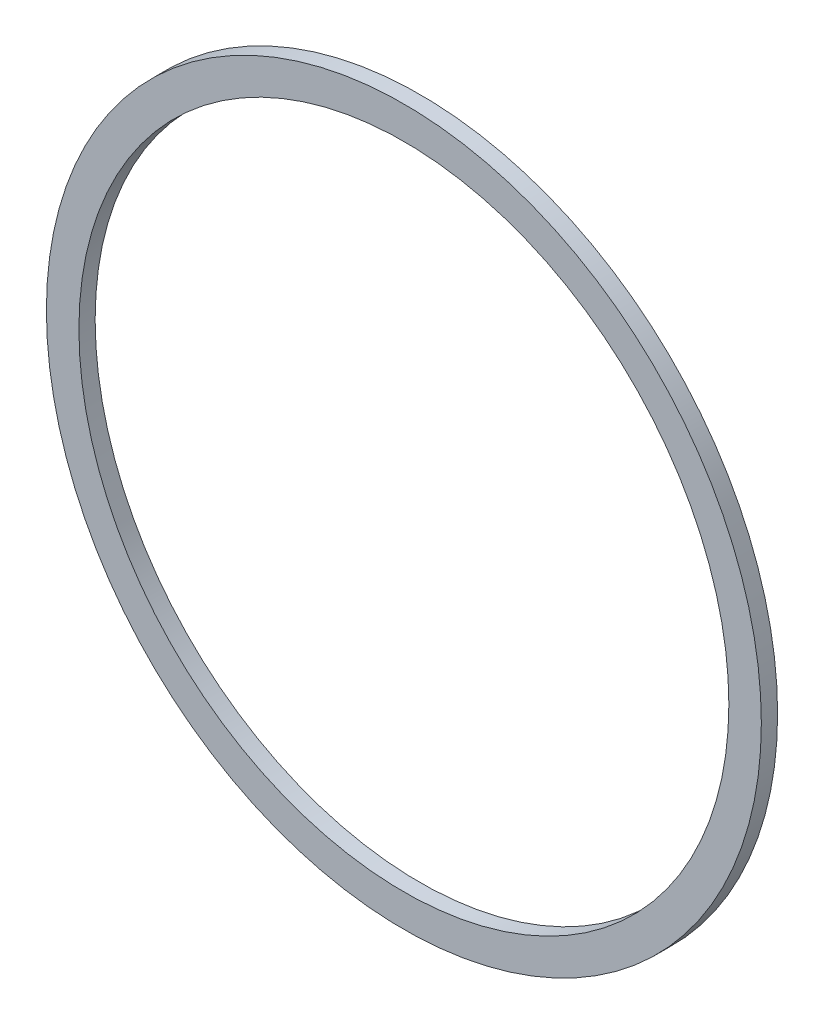
from build123d import *

# Parameters (mm, degrees)
SKETCH1_R          = 558.8
SKETCH1_R_2        = 508
BASE_EXTRUDE_DEPTH = 25.4


with BuildPart() as part:
    # Sketch1 → Base-Extrude (new body)
    with BuildSketch(Plane.XY):
        Circle(SKETCH1_R)
        Circle(SKETCH1_R_2, mode=Mode.SUBTRACT)
    extrude(amount=-BASE_EXTRUDE_DEPTH)


solid = part.part
